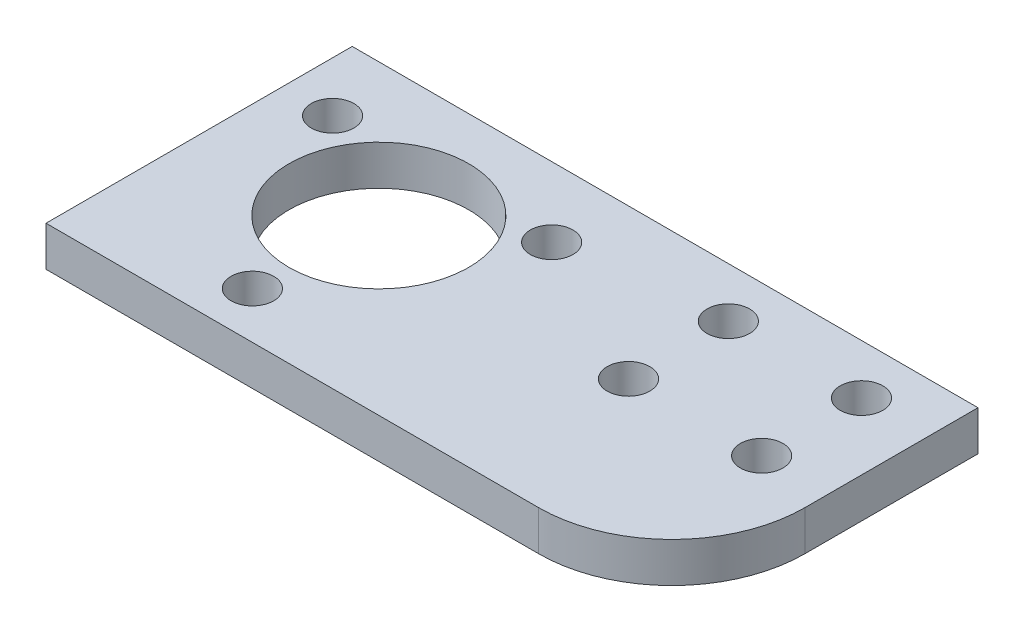
from build123d import *

# Parameters (mm, degrees)
SKETCH_1_W          = 47
SKETCH_1_H          = 23
EXTRUDE_1_DEPTH     = 3
SKETCH_2_R          = 1.6
SKETCH_2_R_2        = 6.75
CUT_EXTRUDE_1_DEPTH = 27.334388165
FILLET_1_R          = 10


with BuildPart() as part:
    # 草图1 → 凸台-拉伸1 (new body)
    with BuildSketch(Plane(origin=(0, 0, 0), x_dir=(1, 0, 0), z_dir=(0, 1, 0))):
        Rectangle(SKETCH_1_W, SKETCH_1_H)
    extrude(amount=EXTRUDE_1_DEPTH)

    # 草图2 → 切除-拉伸1 (cut, through all)
    with BuildSketch(Plane(origin=(0, 3, 0), x_dir=(1, 0, 0), z_dir=(0, 1, 0))):
        with Locations(Location((-19.727241336, 6.25, 0), (0, 0, 270))):
            Circle(SKETCH_2_R)
        with Locations(Location((-11.5, -8, 0), (0, 0, 270))):
            Circle(SKETCH_2_R)
        with Locations(Location((-3.272758664, 6.25, 0), (0, 0, 270))):
            Circle(SKETCH_2_R)
        with Locations(Location((-11.5, 1.5, 0), (0, 0, 270))):
            Circle(SKETCH_2_R_2)
        with Locations(Location((18.5, 7.75, 0), (0, 0, 270))):
            Circle(SKETCH_2_R)
        with Locations(Location((18.5, 0.25, 0), (0, 0, 270))):
            Circle(SKETCH_2_R)
        with Locations(Location((8.5, 0.25, 0), (0, 0, 90))):
            Circle(SKETCH_2_R)
        with Locations(Location((8.5, 7.75, 0), (0, 0, 90))):
            Circle(SKETCH_2_R)
    extrude(amount=-CUT_EXTRUDE_1_DEPTH, mode=Mode.SUBTRACT)

    # 圆角1
    fillet_1_edges = [part.edges().sort_by_distance(p)[0] for p in [
        (23.5, 1.5, 11.5),
    ]]
    fillet(fillet_1_edges, radius=FILLET_1_R)


solid = part.part
